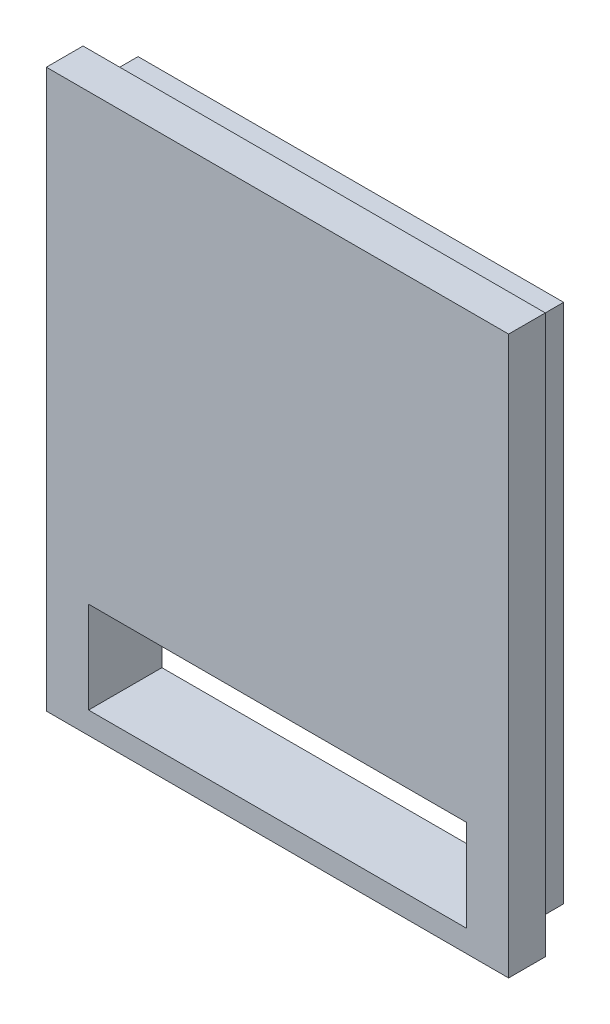
from build123d import *

# Parameters (mm, degrees)
SKETCH2_W           = 12.6
SKETCH2_H           = 15.2
BOSS_EXTRUDE1_DEPTH = 1
SKETCH3_W           = 11.6
SKETCH3_H           = 14.2
BOSS_EXTRUDE2_DEPTH = 1
SKETCH4_W           = 10.3
SKETCH4_H           = 2.5
CUT_EXTRUDE1_DEPTH  = 4


with BuildPart() as part:
    # Sketch2 → Boss-Extrude1 (new body)
    with BuildSketch(Plane.XY):
        Rectangle(SKETCH2_W, SKETCH2_H)
    extrude(amount=BOSS_EXTRUDE1_DEPTH)

    # Sketch3 → Boss-Extrude2 (add)
    with BuildSketch(Plane(origin=(0, 0, 0), x_dir=(-1, 0, 0), z_dir=(0, 0, -1))):
        Rectangle(SKETCH3_W, SKETCH3_H)
    extrude(amount=BOSS_EXTRUDE2_DEPTH)

    # Sketch4 → Cut-Extrude1 (cut)
    with BuildSketch(Plane(origin=(0, 0, -1), x_dir=(-1, 0, 0), z_dir=(0, 0, -1))):
        with Locations((0, -5.75)):
            Rectangle(SKETCH4_W, SKETCH4_H)
    extrude(amount=-CUT_EXTRUDE1_DEPTH, mode=Mode.SUBTRACT)


solid = part.part
